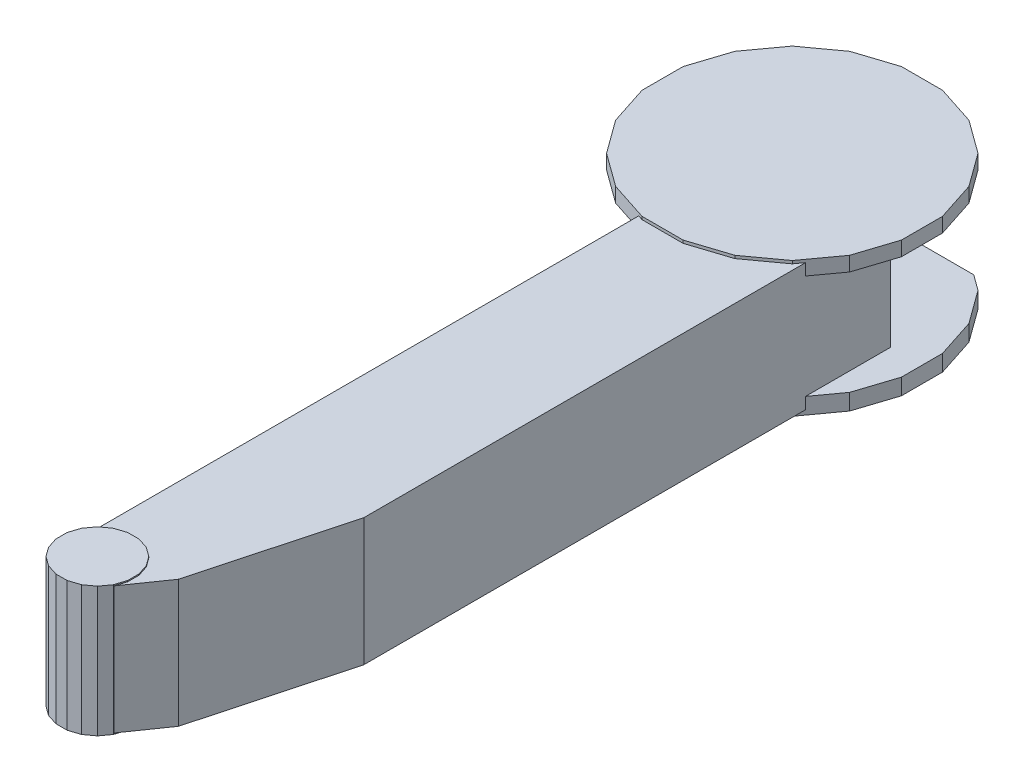
from build123d import *

# Parameters (mm, degrees)
BOSS_EXTRUDE1_DEPTH = 10
BOSS_EXTRUDE2_DEPTH = 90
BOSS_EXTRUDE3_DEPTH = 10
CUT_EXTRUDE1_DEPTH  = 10
CUT_EXTRUDE2_DEPTH  = 90
CUT_EXTRUDE3_DEPTH  = 10
CUT_EXTRUDE4_DEPTH  = 10
CUT_EXTRUDE5_DEPTH  = 10
CUT_EXTRUDE6_DEPTH  = 9.81685291
SKETCH10_W          = 107
SKETCH10_H          = 90
CUT_EXTRUDE7_DEPTH  = 80.18314709
SKETCH11_W          = 6
SKETCH11_H          = 51
CUT_EXTRUDE8_DEPTH  = 134.567114958
BOSS_EXTRUDE4_DEPTH = 4
BOSS_EXTRUDE5_DEPTH = 1
BOSS_EXTRUDE6_DEPTH = 1
BOSS_EXTRUDE7_DEPTH = 2.5
DRAFT1_ANGLE        = 18
CHAMFER1_SIZE       = 6.379377731
CHAMFER1_SIZE2      = 12.134297522


with BuildPart() as part:
    # Sketch1 → Boss-Extrude1 (new body)
    with BuildSketch(Plane(origin=(0, -45, 0), x_dir=(1, 0, 0), z_dir=(0, 1, 0))):
        Polygon((101.03665965, 51.480749424), (85, 73.553317831), (85, 90), (66.671408228, 90), (51.480749424, 101.03665965), (17.739057316, 112), (-17.739057316, 112), (-51.480749424, 101.03665965), (-80.18314709, 80.18314709), (-101.03665965, 51.480749424), (-112, 17.739057316), (-112, -17.739057316), (-101.03665965, -51.480749424), (-80.18314709, -80.18314709), (-51.480749424, -101.03665965), (-22, -110.615535798), (-22, -577.665828314), (-22.193549641, -577.806450359), (-27.96550401, -585.750863999), (-31, -595.09008235), (-31, -604.90991765), (-27.96550401, -614.249136001), (-22.193549641, -622.193549641), (-14.249136001, -627.96550401), (-4.90991765, -631), (4.90991765, -631), (14.249136001, -627.96550401), (22.193549641, -622.193549641), (27.96550401, -614.249136001), (28.064334249, -613.944967802), (51, -581), (85, -455), (85, -73.553317831), (101.03665965, -51.480749424), (112, -17.739057316), (112, 17.739057316), align=None)
    extrude(amount=-BOSS_EXTRUDE1_DEPTH)

    # Sketch2 → Boss-Extrude2 (add)
    with BuildSketch(Plane(origin=(0, -45, 0), x_dir=(-1, 0, 0), z_dir=(0, 1, 0))):
        Polygon((-85, -90), (-85, 455), (-51, 581), (-28.064334249, 613.944967802), (-27.96550401, 614.249136001), (-22.193549641, 622.193549641), (-14.249136001, 627.96550401), (-4.90991765, 631), (4.90991765, 631), (14.249136001, 627.96550401), (22.193549641, 622.193549641), (27.96550401, 614.249136001), (31, 604.90991765), (31, 595.09008235), (27.96550401, 585.750863999), (22.193549641, 577.806450359), (22, 577.665828314), (22, 110.615535798), (51.480749424, 101.03665965), (80.18314709, 80.18314709), (101.03665965, 51.480749424), (112, 17.739057316), (112, -17.739057316), (101.03665965, -51.480749424), (80.18314709, -80.18314709), (51.480749424, -101.03665965), (17.739057316, -112), (-17.739057316, -112), (-51.480749424, -101.03665965), (-66.671408228, -90), align=None)
    extrude(amount=BOSS_EXTRUDE2_DEPTH)

    # Sketch3 → Boss-Extrude3 (add)
    with BuildSketch(Plane(origin=(0, 45, 0), x_dir=(-1, 0, 0), z_dir=(0, 1, 0))):
        Polygon((-85, -73.553317831), (-101.03665965, -51.480749424), (-112, -17.739057316), (-112, 17.739057316), (-101.03665965, 51.480749424), (-85, 73.553317831), (-85, 455), (-51, 581), (-28.064334249, 613.944967802), (-27.96550401, 614.249136001), (-22.193549641, 622.193549641), (-14.249136001, 627.96550401), (-4.90991765, 631), (4.90991765, 631), (14.249136001, 627.96550401), (22.193549641, 622.193549641), (27.96550401, 614.249136001), (31, 604.90991765), (31, 595.09008235), (27.96550401, 585.750863999), (22.193549641, 577.806450359), (22, 577.665828314), (22, 110.615535798), (51.480749424, 101.03665965), (80.18314709, 80.18314709), (101.03665965, 51.480749424), (112, 17.739057316), (112, -17.739057316), (101.03665965, -51.480749424), (80.18314709, -80.18314709), (51.480749424, -101.03665965), (17.739057316, -112), (-17.739057316, -112), (-51.480749424, -101.03665965), (-66.671408228, -90), (-85, -90), align=None)
    extrude(amount=BOSS_EXTRUDE3_DEPTH)

    # Sketch4 → Cut-Extrude1 (cut)
    with BuildSketch(Plane.XZ.offset(55)):
        Polygon((-30.023339436, 89.432885042), (-22, 89.432885042), (-22, 110.615535798), (-51.480749424, 101.03665965), (-80.18314709, 80.18314709), (-101.03665965, 51.480749424), (-112, 17.739057316), (-112, -17.739057316), (-101.03665965, -51.480749424), (-80.18314709, -80.18314709), (-51.480749424, -101.03665965), (-17.739057316, -112), (17.739057316, -112), (51.480749424, -101.03665965), (66.671408228, -90), (-22, -90), (-22, -87.483366864), (-41.368459358, -81.190172933), (-64.432886054, -64.432886054), (-81.190172933, -41.368459358), (-90, -14.254599629), (-90, 14.254599629), (-81.190172933, 41.368459358), (-64.432886054, 64.432886054), align=None)
    extrude(amount=-CUT_EXTRUDE1_DEPTH, mode=Mode.SUBTRACT)

    # Sketch5 → Cut-Extrude2 (cut)
    with BuildSketch(Plane.XZ.offset(45)):
        Polygon((66.671408228, -90), (-22, -90), (-22, 110.615535798), (-51.480749424, 101.03665965), (-80.18314709, 80.18314709), (-101.03665965, 51.480749424), (-112, 17.739057316), (-112, -17.739057316), (-101.03665965, -51.480749424), (-80.18314709, -80.18314709), (-51.480749424, -101.03665965), (-17.739057316, -112), (17.739057316, -112), (51.480749424, -101.03665965), align=None)
    extrude(amount=-CUT_EXTRUDE2_DEPTH, mode=Mode.SUBTRACT)

    # Sketch6 → Cut-Extrude3 (cut)
    with BuildSketch(Plane.XZ.offset(55)):
        Polygon((85, -90), (85, -73.553317831), (73.050785959, -90), align=None)
    extrude(amount=-CUT_EXTRUDE3_DEPTH, mode=Mode.SUBTRACT)

    # Sketch7 → Cut-Extrude4 (cut)
    with BuildSketch(Plane.XZ.offset(55)):
        Polygon((-14.254599629, -90), (-22, -87.483366864), (-22, -90), align=None)
    extrude(amount=-CUT_EXTRUDE4_DEPTH, mode=Mode.SUBTRACT)

    # Sketch8 → Cut-Extrude5 (cut)
    with BuildSketch(Plane(origin=(0, 55, 0), x_dir=(-1, 0, 0), z_dir=(0, 1, 0))):
        Polygon((-80.18314709, -80.18314709), (-85, -73.553317831), (-85, -90), (-66.671408228, -90), align=None)
    extrude(amount=-CUT_EXTRUDE5_DEPTH, mode=Mode.SUBTRACT)

    # Sketch9 → Cut-Extrude6 (cut)
    with BuildSketch(Plane(origin=(0, 0, -90), x_dir=(-1, 0, 0), z_dir=(0, 0, -1))):
        Polygon((-80.18314709, -45), (22, -45), (22, 45), (-80.18314709, 45), (-85, 45), (-85, -45), align=None)
    extrude(amount=-CUT_EXTRUDE6_DEPTH, mode=Mode.SUBTRACT)

    # Sketch10 → Cut-Extrude7 (cut)
    with BuildSketch(Plane(origin=(0, 0, -80.18314709), x_dir=(-1, 0, 0), z_dir=(0, 0, -1))):
        with Locations((-31.5, 0)):
            Rectangle(SKETCH10_W, SKETCH10_H)
    extrude(amount=-CUT_EXTRUDE7_DEPTH, mode=Mode.SUBTRACT)

    # Sketch11 → Cut-Extrude8 (cut)
    with BuildSketch(Plane(origin=(0, 0, 89.432885042), x_dir=(-1, 0, 0), z_dir=(0, 0, -1))):
        with Locations((19, -29.5)):
            Rectangle(SKETCH11_W, SKETCH11_H)
    extrude(amount=-CUT_EXTRUDE8_DEPTH, mode=Mode.SUBTRACT)

    # Sketch12 → Boss-Extrude4 (add)
    with BuildSketch(Plane.XZ.offset(55)):
        Polygon((-16, 89.432885042), (-16, 112), (17.739057316, 112), (51.480749424, 101.03665965), (80.18314709, 80.18314709), (101.03665965, 51.480749424), (112, 17.739057316), (112, -17.739057316), (101.03665965, -51.480749424), (73.050785959, -90), (-14.254599629, -90), (-41.368459358, -81.190172933), (-64.432886054, -64.432886054), (-81.190172933, -41.368459358), (-90, -14.254599629), (-90, 14.254599629), (-81.190172933, 41.368459358), (-64.432886054, 64.432886054), (-30.023339436, 89.432885042), align=None)
    extrude(amount=BOSS_EXTRUDE4_DEPTH)

    # Sketch13 → Boss-Extrude5 (add)
    with BuildSketch(Plane.XZ.offset(55)):
        Polygon((22.193549641, 577.806450359), (14.249136001, 572.03449599), (4.90991765, 569), (-4.90991765, 569), (-14.249136001, 572.03449599), (-22.193549641, 577.806450359), (-27.96550401, 585.750863999), (-31, 595.09008235), (-31, 604.90991765), (-27.96550401, 614.249136001), (-22.193549641, 622.193549641), (-14.249136001, 627.96550401), (-4.90991765, 631), (4.90991765, 631), (14.249136001, 627.96550401), (22.193549641, 622.193549641), (27.96550401, 614.249136001), (31, 604.90991765), (31, 595.09008235), (27.96550401, 585.750863999), align=None)
    extrude(amount=BOSS_EXTRUDE5_DEPTH)

    # Sketch14 → Boss-Extrude6 (add)
    with BuildSketch(Plane(origin=(0, 55, 0), x_dir=(-1, 0, 0), z_dir=(0, 1, 0))):
        Polygon((-14.249136001, 572.03449599), (-22.193549641, 577.806450359), (-27.96550401, 585.750863999), (-31, 595.09008235), (-31, 604.90991765), (-27.96550401, 614.249136001), (-22.193549641, 622.193549641), (-14.249136001, 627.96550401), (-4.90991765, 631), (4.90991765, 631), (14.249136001, 627.96550401), (22.193549641, 622.193549641), (27.96550401, 614.249136001), (31, 604.90991765), (31, 595.09008235), (27.96550401, 585.750863999), (22.193549641, 577.806450359), (14.249136001, 572.03449599), (4.90991765, 569), (-4.90991765, 569), align=None)
    extrude(amount=BOSS_EXTRUDE6_DEPTH)

    # Sketch15 → Boss-Extrude7 (add)
    with BuildSketch(Plane(origin=(0, 55, 0), x_dir=(-1, 0, 0), z_dir=(0, 1, 0))):
        Polygon((-80.18314709, -80.18314709), (-101.03665965, -51.480749424), (-112, -17.739057316), (-112, 17.739057316), (-101.03665965, 51.480749424), (-80.18314709, 80.18314709), (-51.480749424, 101.03665965), (-17.739057316, 112), (17.739057316, 112), (51.480749424, 101.03665965), (80.18314709, 80.18314709), (101.03665965, 51.480749424), (112, 17.739057316), (112, -17.739057316), (101.03665965, -51.480749424), (80.18314709, -80.18314709), (51.480749424, -101.03665965), (17.739057316, -112), (-17.739057316, -112), (-51.480749424, -101.03665965), align=None)
    extrude(amount=BOSS_EXTRUDE7_DEPTH)

    # Draft1
    draft1_faces = [part.faces().sort_by_distance(p)[0] for p in [
        (-20.780579815, -36.705876441, 89.432885042),
    ]]
    draft(draft1_faces, Plane(origin=(-16, -4, 224), x_dir=(0, 0, -1), z_dir=(-1, 0, 0)), DRAFT1_ANGLE)

    # Chamfer1
    chamfer1_edges = [part.edges().sort_by_distance(p)[0] for p in [
        (73.050785959, -52, -90),
    ]]
    chamfer1_side = [part.faces().sort_by_distance(p)[0] for p in [
        (29.398093165, -52, -90),
    ]]
    chamfer(chamfer1_edges, length=CHAMFER1_SIZE, length2=CHAMFER1_SIZE2, reference=chamfer1_side[0])


solid = part.part
